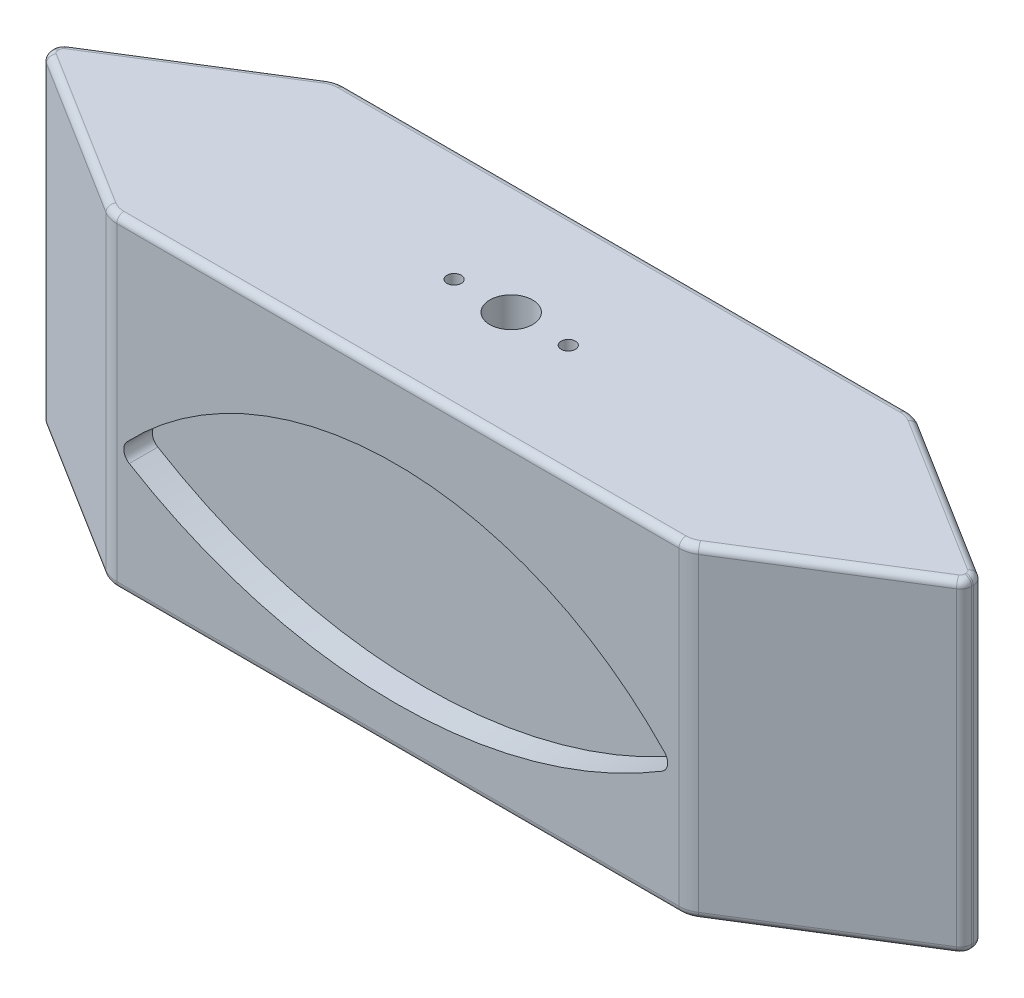
from build123d import *

# Parameters (mm, degrees)
BOSS_EXTRUDE1_DEPTH      = 25.4
BOSS_EXTRUDE1_DEPTH_BACK = 25.4
SKETCH1_W                = 204.950025332
SKETCH1_H                = 72.158698858
SKETCH2_W                = 220.605080335
SKETCH2_H                = 76.557810487
SKETCH2_R                = 4.7625
CUT_EXTRUDE1_DEPTH       = 219.761401313
FILLET1_R                = 1.5875
CUT_EXTRUDE2_DEPTH       = 6.35
SKETCH4_R                = 1.5875
CUT_EXTRUDE3_DEPTH       = 12.7
SKETCH5_R                = 1.5875
CUT_EXTRUDE4_DEPTH       = 12.7


with BuildPart() as part:
    # Sketch1 → Boss-Extrude1 (new, two sides: drawn at the far end of the back side and taken through both)
    with BuildSketch(Plane.XY.offset(-BOSS_EXTRUDE1_DEPTH_BACK)):
        with Locations((102.475012666, 366.768835108)):
            Rectangle(SKETCH1_W, SKETCH1_H)
    extrude(amount=BOSS_EXTRUDE1_DEPTH + BOSS_EXTRUDE1_DEPTH_BACK)

    # Sketch2 → Cut-Extrude1 (cut, through all)
    # profile 1 of 2: a face of its own
    with BuildSketch(Plane(origin=(0, 402.848184537, 0), x_dir=(1, 0, 0), z_dir=(0, 1, 0))):
        with Locations((101.602425497, 0.332919425)):
            Rectangle(SKETCH2_W, SKETCH2_H)
        with BuildLine():
            Line((36.555662769, -24.43478923), (1.193802692, -2.333626683))
            ThreePointArc((1.193802692, -2.333626683), (0.318408098, -1.411023063), (0, -0.179710991))
            Line((0, -0.179710991), (0, 0.179710991))
            ThreePointArc((0, 0.179710991), (0.318408098, 1.411023063), (1.193802692, 2.333626683))
            Line((1.193802692, 2.333626683), (36.555662769, 24.43478923))
            ThreePointArc((36.555662769, 24.43478923), (38.17057208, 25.153929538), (39.921156038, 25.4))
            Line((39.921156038, 25.4), (165.028869294, 25.4))
            ThreePointArc((165.028869294, 25.4), (166.779453252, 25.153929538), (168.394362563, 24.43478923))
            Line((168.394362563, 24.43478923), (203.756222639, 2.333626683))
            ThreePointArc((203.756222639, 2.333626683), (204.631617234, 1.411023063), (204.950025332, 0.179710991))
            Line((204.950025332, 0.179710991), (204.950025332, -0.179710991))
            ThreePointArc((204.950025332, -0.179710991), (204.631617234, -1.411023063), (203.756222639, -2.333626683))
            Line((203.756222639, -2.333626683), (168.394362563, -24.43478923))
            ThreePointArc((168.394362563, -24.43478923), (166.779453252, -25.153929538), (165.028869294, -25.4))
            Line((165.028869294, -25.4), (39.921156038, -25.4))
            ThreePointArc((39.921156038, -25.4), (38.17057208, -25.153929538), (36.555662769, -24.43478923))
        make_face(mode=Mode.SUBTRACT)
    # profile 2 of 2: a face of its own
    with BuildSketch(Plane(origin=(0, 402.848184537, 0), x_dir=(1, 0, 0), z_dir=(0, 1, 0))):
        with Locations((102.475012666, -0.179710991)):
            Circle(SKETCH2_R)
    extrude(amount=-CUT_EXTRUDE1_DEPTH, mode=Mode.SUBTRACT)

    # Fillet1
    fillet1_edges = [part.edges().sort_by_distance(p)[0] for p in [
        (38.17057208, 330.689485679, 25.153929538),
        (18.874732731, 330.689485679, 13.384207957),
        (0.318408098, 330.689485679, 1.411023063),
        (0, 330.689485679, 0),
        (0.318408098, 330.689485679, -1.411023063),
        (18.874732731, 330.689485679, -13.384207957),
        (38.17057208, 330.689485679, -25.153929538),
        (102.475012666, 330.689485679, -25.4),
        (166.779453252, 330.689485679, -25.153929538),
        (186.075292601, 330.689485679, -13.384207957),
        (204.631617234, 330.689485679, -1.411023063),
        (204.950025332, 330.689485679, 0),
        (204.631617234, 330.689485679, 1.411023063),
        (186.075292601, 330.689485679, 13.384207957),
        (166.779453252, 330.689485679, 25.153929538),
        (0.318408098, 402.848184537, 1.411023063),
        (0, 402.848184537, 0),
        (0.318408098, 402.848184537, -1.411023063),
        (18.874732731, 402.848184537, -13.384207957),
        (38.17057208, 402.848184537, -25.153929538),
        (102.475012666, 402.848184537, -25.4),
        (166.779453252, 402.848184537, -25.153929538),
        (186.075292601, 402.848184537, -13.384207957),
        (204.631617234, 402.848184537, -1.411023063),
        (204.950025332, 402.848184537, 0),
        (204.631617234, 402.848184537, 1.411023063),
        (186.075292601, 402.848184537, 13.384207957),
        (166.779453252, 402.848184537, 25.153929538),
        (102.475012666, 402.848184537, 25.4),
        (38.17057208, 402.848184537, 25.153929538),
        (102.475012666, 330.689485679, 25.4),
        (18.874732731, 402.848184537, 13.384207957),
    ]]
    fillet(fillet1_edges, radius=FILLET1_R)

    # Sketch3 → Cut-Extrude2 (cut)
    with BuildSketch(Plane.XY.offset(25.4)):
        with BuildLine():
            ThreePointArc((42.179379055, 360.341209381), (101.998613328, 386.003937421), (161.817847601, 360.341209381))
            ThreePointArc((161.817847601, 360.341209381), (162.494976111, 358.255146927), (161.294952196, 356.419363121))
            ThreePointArc((161.294952196, 356.419363121), (101.998613328, 339.835452874), (42.702274459, 356.419363121))
            ThreePointArc((42.702274459, 356.419363121), (41.502250545, 358.255146927), (42.179379055, 360.341209381))
        make_face()
    cut_extrude2 = extrude(amount=-CUT_EXTRUDE2_DEPTH, mode=Mode.SUBTRACT)

    # Mirror1: Cut-Extrude2 across plane
    add(cut_extrude2.mirror(Plane.XY), mode=Mode.SUBTRACT)

    # Sketch4 → Cut-Extrude3 (cut)
    with BuildSketch(Plane.XZ.offset(-330.689485679)):
        with Locations((92.950012666, 0.179710991)):
            Circle(SKETCH4_R)
        with Locations((112.000012666, 0.179710991)):
            Circle(SKETCH4_R)
    extrude(amount=-CUT_EXTRUDE3_DEPTH, mode=Mode.SUBTRACT)

    # Sketch5 → Cut-Extrude4 (cut)
    with BuildSketch(Plane(origin=(0, 402.848184537, 0), x_dir=(1, 0, 0), z_dir=(0, 1, 0))):
        with Locations((89.775012666, -0.179710991)):
            Circle(SKETCH5_R)
        with Locations((115.175012666, -0.179710991)):
            Circle(SKETCH5_R)
    extrude(amount=-CUT_EXTRUDE4_DEPTH, mode=Mode.SUBTRACT)


solid = part.part
